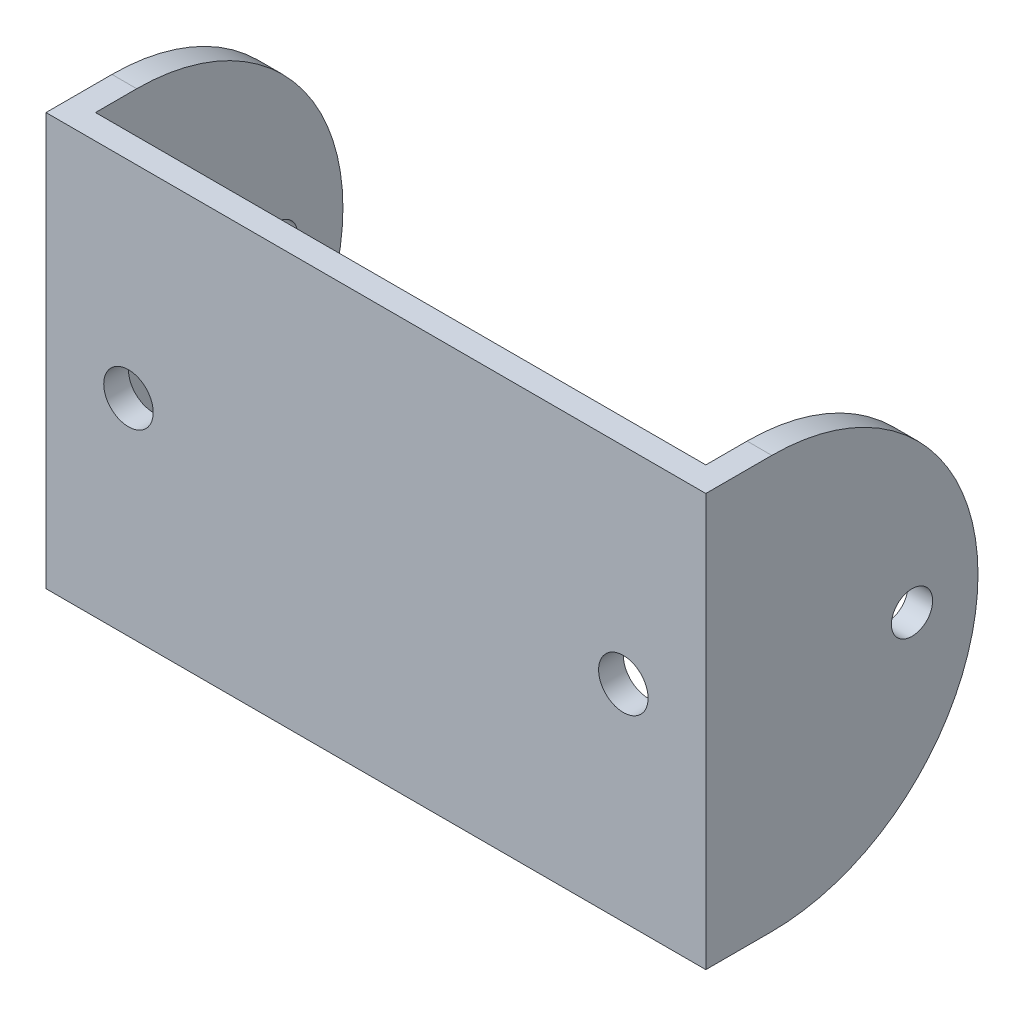
from build123d import *

# Parameters (mm, degrees)
SKETCH1_W           = 80
SKETCH1_H           = 50
BOSS_EXTRUDE1_DEPTH = 3
CUT_EXTRUDE1_REACH  = 49.265
SKETCH2_R           = 3
SKETCH3_W           = 3
SKETCH3_H           = 50
BOSS_EXTRUDE2_DEPTH = 30
FILLET1_RADIUS      = 25
FILLET1_LENGTH      = 3
FILLET2_RADIUS      = 25
FILLET2_LENGTH      = 3
SKETCH4_R           = 2.5
CUT_EXTRUDE2_DEPTH  = 200


with BuildPart() as part:
    # Sketch1 → Boss-Extrude1 (new body)
    with BuildSketch(Plane.XY):
        Rectangle(SKETCH1_W, SKETCH1_H)
    extrude(amount=BOSS_EXTRUDE1_DEPTH)

    # Sketch2 → Cut-Extrude1 (cut, up to next)
    with BuildSketch(Plane(origin=(0, 0, 0), x_dir=(-1, 0, 0), z_dir=(0, 0, -1)), mode=Mode.PRIVATE) as cut_extrude1_sk1:
        with Locations((-30, 0)):
            Circle(SKETCH2_R)
    cut_extrude1_tool1 = extrude(cut_extrude1_sk1.sketch, amount=-CUT_EXTRUDE1_REACH, mode=Mode.PRIVATE) & part.part
    # Sketch2 → Cut-Extrude1 (cut, up to next)
    with BuildSketch(Plane(origin=(0, 0, 0), x_dir=(-1, 0, 0), z_dir=(0, 0, -1)), mode=Mode.PRIVATE) as cut_extrude1_sk2:
        with Locations((30, 0)):
            Circle(SKETCH2_R)
    cut_extrude1_tool2 = extrude(cut_extrude1_sk2.sketch, amount=-CUT_EXTRUDE1_REACH, mode=Mode.PRIVATE) & part.part
    add(cut_extrude1_tool1.solids().sort_by_distance((30, 0, 0))[0], mode=Mode.SUBTRACT)
    add(cut_extrude1_tool2.solids().sort_by_distance((-30, 0, 0))[0], mode=Mode.SUBTRACT)

    # Sketch3 → Boss-Extrude2 (add)
    with BuildSketch(Plane(origin=(0, 0, 0), x_dir=(-1, 0, 0), z_dir=(0, 0, -1))):
        with Locations((-38.5, 0)):
            Rectangle(SKETCH3_W, SKETCH3_H)
        with Locations((38.5, 0)):
            Rectangle(SKETCH3_W, SKETCH3_H)
    extrude(amount=BOSS_EXTRUDE2_DEPTH)

    # Fillet1: full round fillet: the end face becomes a half cylinder, R = half its width
    fillet1_face = Plane((38.5, 0, -30), x_dir=(-1, 0, 0), z_dir=(0, 0, -1))  # on the end face: x along it, z out of the body
    fillet1_slab = fillet1_face.offset(-FILLET1_RADIUS / 2) * Box(FILLET1_LENGTH, 2 * FILLET1_RADIUS, FILLET1_RADIUS, mode=Mode.PRIVATE)  # the body's end, R deep
    fillet1_round = Plane((38.5, 0, -5), x_dir=(0, 0, -1), z_dir=(-1, 0, 0)) * Cylinder(FILLET1_RADIUS, FILLET1_LENGTH, mode=Mode.PRIVATE)  # its axis R under the face
    add(fillet1_slab - fillet1_round, mode=Mode.SUBTRACT)

    # Fillet2: full round fillet: the end face becomes a half cylinder, R = half its width
    fillet2_face = Plane((-38.5, 0, -30), x_dir=(1, 0, 0), z_dir=(0, 0, -1))  # on the end face: x along it, z out of the body
    fillet2_slab = fillet2_face.offset(-FILLET2_RADIUS / 2) * Box(FILLET2_LENGTH, 2 * FILLET2_RADIUS, FILLET2_RADIUS, mode=Mode.PRIVATE)  # the body's end, R deep
    fillet2_round = Plane((-38.5, 0, -5), x_dir=(0, 0, -1), z_dir=(1, 0, 0)) * Cylinder(FILLET2_RADIUS, FILLET2_LENGTH, mode=Mode.PRIVATE)  # its axis R under the face
    add(fillet2_slab - fillet2_round, mode=Mode.SUBTRACT)

    # Sketch4 → Cut-Extrude2 (cut)
    with BuildSketch(Plane(origin=(40, 0, 0), x_dir=(0, 0, -1), z_dir=(1, 0, 0))):
        with Locations((22, 0)):
            Circle(SKETCH4_R)
    extrude(amount=-CUT_EXTRUDE2_DEPTH, mode=Mode.SUBTRACT)


solid = part.part
